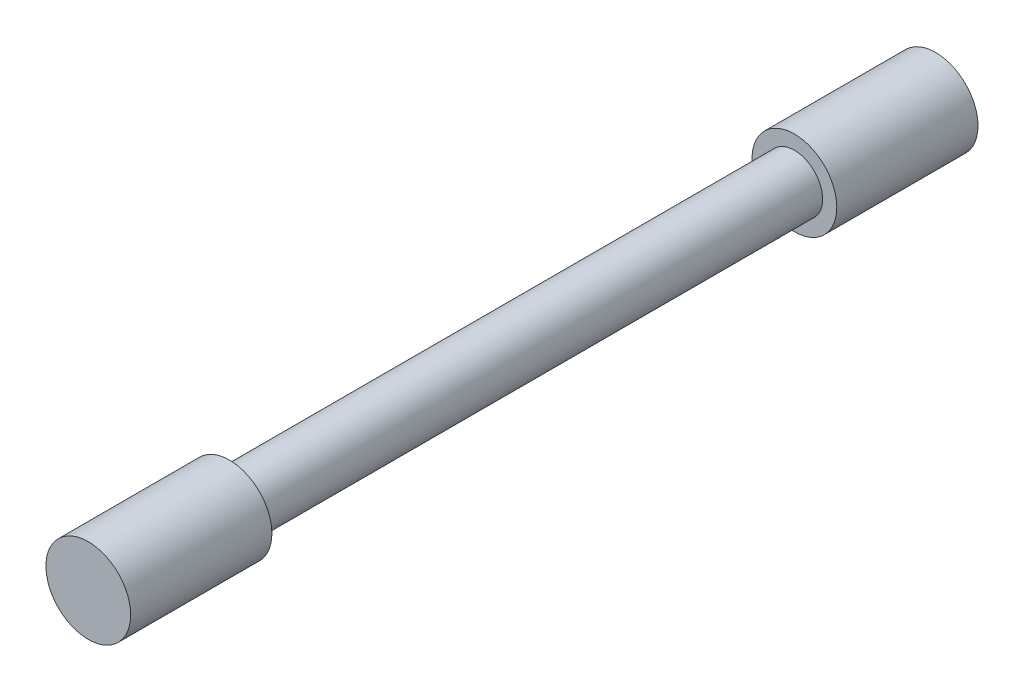
from build123d import *

# Parameters (mm, degrees)
BOSS_EXTRUDE1_DEPTH      = 20
BOSS_EXTRUDE1_DEPTH_BACK = 20
SKETCH1_R                = 2
SKETCH2_R                = 3
BOSS_EXTRUDE2_DEPTH      = 10


with BuildPart() as part:
    # Sketch1 → Boss-Extrude1 (new, two sides: drawn at the far end of the back side and taken through both)
    with BuildSketch(Plane.XY.offset(-BOSS_EXTRUDE1_DEPTH_BACK)):
        Circle(SKETCH1_R)
    extrude(amount=BOSS_EXTRUDE1_DEPTH + BOSS_EXTRUDE1_DEPTH_BACK)

    # Sketch2 → Boss-Extrude2 (add)
    with BuildSketch(Plane.XY.offset(20)):
        Circle(SKETCH2_R)
    boss_extrude2 = extrude(amount=BOSS_EXTRUDE2_DEPTH)

    # Mirror1: Boss-Extrude2 across plane
    add(boss_extrude2.mirror(Plane.XY))


solid = part.part
